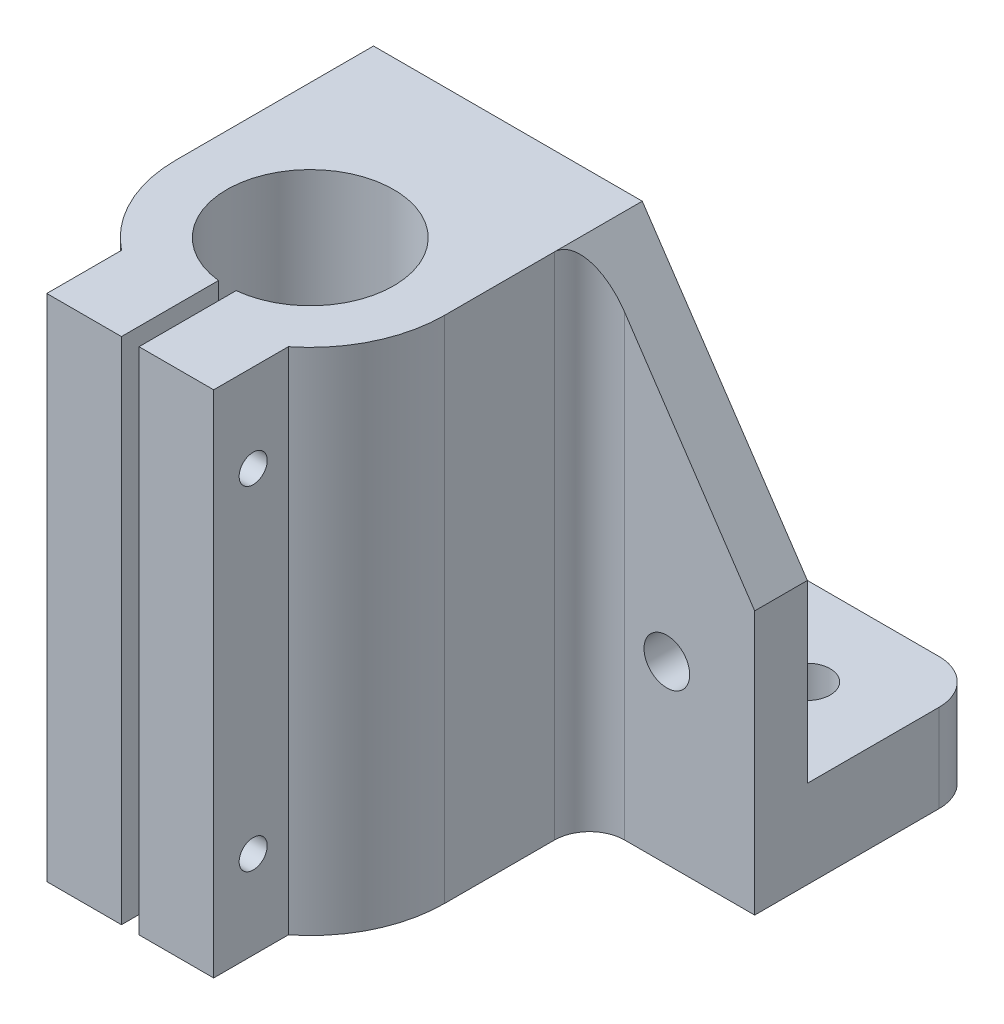
from build123d import *

# Parameters (mm, degrees)
BOSS_EXTRUDE1_DEPTH = 58
CUT_EXTRUDE1_DEPTH  = 80.848669369
SKETCH3_W           = 68.2
SKETCH3_H           = 10
BOSS_EXTRUDE2_DEPTH = 20
SKETCH4_R           = 1.6
CUT_EXTRUDE2_DEPTH  = 85.344294413
SKETCH5_R           = 2.6
CUT_EXTRUDE3_DEPTH  = 80.848669369
SKETCH6_R           = 2.6
CUT_EXTRUDE4_DEPTH  = 73.909601562
CUT_EXTRUDE5_DEPTH  = 77.784178058
FILLET1_R           = 4
FILLET2_R           = 5


with BuildPart() as part:
    # Sketch1 → Boss-Extrude1 (new body)
    with BuildSketch(Plane(origin=(0, 0, 0), x_dir=(1, 0, 0), z_dir=(0, 1, 0))):
        with BuildLine():
            Line((0, 0), (34.1, 0))
            Line((34.1, 0), (34.1, -6))
            Line((34.1, -6), (15.3, -6))
            Line((15.3, -6), (15.3, -22.5))
            ThreePointArc((15.3, -22.5), (13.77388834, -29.161080993), (9.5, -34.49333148))
            Line((9.5, -34.49333148), (9.5, -43))
            Line((9.5, -43), (-9.5, -43))
            Line((-9.5, -43), (-9.5, -34.49333148))
            ThreePointArc((-9.5, -34.49333148), (-13.77388834, -29.161080993), (-15.3, -22.5))
            Line((-15.3, -22.5), (-15.3, -6))
            Line((-15.3, -6), (-34.1, -6))
            Line((-34.1, -6), (-34.1, 0))
            Line((-34.1, 0), (0, 0))
        make_face()
    extrude(amount=BOSS_EXTRUDE1_DEPTH)

    # Sketch2 → Cut-Extrude1 (cut, through all)
    with BuildSketch(Plane(origin=(0, 58, 0), x_dir=(1, 0, 0), z_dir=(0, 1, 0))):
        with BuildLine():
            Line((-1, -31.947221814), (-1, -43))
            Line((-1, -43), (1, -43))
            Line((1, -43), (1, -31.947221814))
            ThreePointArc((1, -31.947221814), (0, -13), (-1, -31.947221814))
        make_face()
    extrude(amount=-CUT_EXTRUDE1_DEPTH, mode=Mode.SUBTRACT)

    # Sketch3 → Boss-Extrude2 (add)
    with BuildSketch(Plane(origin=(0, 0, 0), x_dir=(-1, 0, 0), z_dir=(0, 0, -1))):
        with Locations((0, 5)):
            Rectangle(SKETCH3_W, SKETCH3_H)
    extrude(amount=BOSS_EXTRUDE2_DEPTH)

    # Sketch4 → Cut-Extrude2 (cut, through all)
    with BuildSketch(Plane(origin=(9.5, 0, 0), x_dir=(0, 0, -1), z_dir=(1, 0, 0))):
        with Locations((-38.5, 48)):
            Circle(SKETCH4_R)
        with Locations((-38.5, 10)):
            Circle(SKETCH4_R)
    extrude(amount=-CUT_EXTRUDE2_DEPTH, mode=Mode.SUBTRACT)

    # Sketch5 → Cut-Extrude3 (cut, through all)
    with BuildSketch(Plane(origin=(0, 0, 0), x_dir=(-1, 0, 0), z_dir=(0, 0, -1))):
        with Locations((-24.1, 20)):
            Circle(SKETCH5_R)
        with Locations((24.1, 20)):
            Circle(SKETCH5_R)
    extrude(amount=-CUT_EXTRUDE3_DEPTH, mode=Mode.SUBTRACT)

    # Sketch6 → Cut-Extrude4 (cut, through all)
    with BuildSketch(Plane(origin=(0, 10, 0), x_dir=(1, 0, 0), z_dir=(0, 1, 0))):
        with Locations(Location((24.1, 10, 0), (0, 0, 270))):
            Circle(SKETCH6_R)
        with Locations(Location((0, 10, 0), (0, 0, 270))):
            Circle(SKETCH6_R)
        with Locations(Location((-24.1, 10, 0), (0, 0, 270))):
            Circle(SKETCH6_R)
    extrude(amount=-CUT_EXTRUDE4_DEPTH, mode=Mode.SUBTRACT)

    # Sketch7 → Cut-Extrude5 (cut, through all)
    with BuildSketch(Plane.XY.offset(6)):
        Polygon((15.3, 58), (34.1, 30), (34.1, 58), align=None)
        Polygon((-15.3, 58), (-34.1, 58), (-34.1, 30), align=None)
    extrude(amount=-CUT_EXTRUDE5_DEPTH, mode=Mode.SUBTRACT)

    # Fillet1
    fillet1_edges = [part.edges().sort_by_distance(p)[0] for p in [
        (15.3, 29, 6),
        (-15.3, 29, 6),
    ]]
    fillet(fillet1_edges, radius=FILLET1_R)

    # Fillet2
    fillet2_edges = [part.edges().sort_by_distance(p)[0] for p in [
        (-34.1, 5, -20),
        (34.1, 5, -20),
    ]]
    fillet(fillet2_edges, radius=FILLET2_R)


solid = part.part
